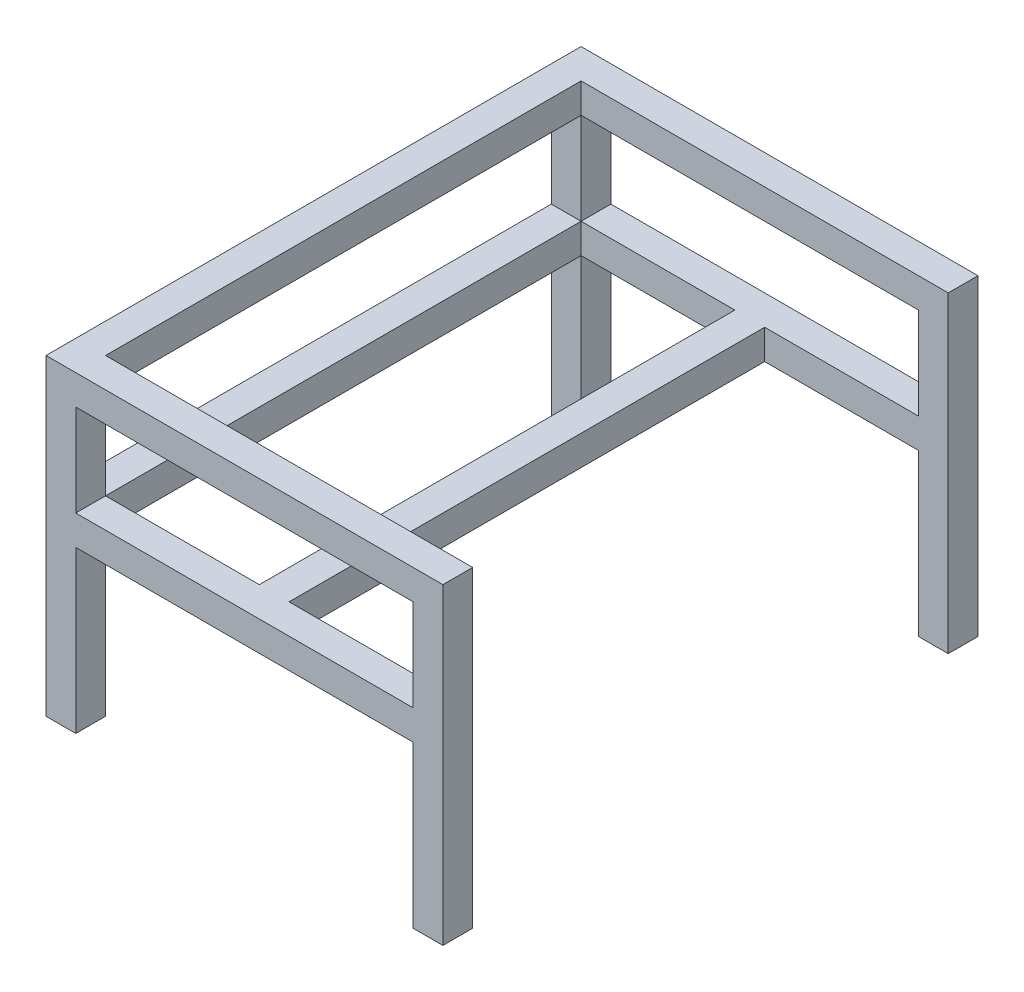
from build123d import *

# Parameters (mm, degrees)
CROQUIS1_W              = 1016.2
CROQUIS1_H              = 1370
SALIENTE_EXTRUIR1_DEPTH = 800
CORTAR_EXTRUIR1_DEPTH   = 723.8
CROQUIS3_W              = 863.8
CROQUIS3_H              = 1217.6
CORTAR_EXTRUIR2_DEPTH   = 76.2
CROQUIS5_W              = 1217.6
CROQUIS5_H              = 76.2
SALIENTE_EXTRUIR2_DEPTH = 76.2
CROQUIS6_W              = 863.8
CROQUIS6_H              = 76.2
SALIENTE_EXTRUIR3_DEPTH = 76.2
CROQUIS7_W              = 1217.6
CROQUIS7_H              = 76.2
SALIENTE_EXTRUIR4_DEPTH = 76.2
CROQUIS8_W              = 863.8
CROQUIS8_H              = 76.2
SALIENTE_EXTRUIR5_DEPTH = 76.2
CROQUIS9_W              = 76.2
CROQUIS9_H              = 1217.6
CORTAR_EXTRUIR4_DEPTH   = 387.4
CROQUIS10_W             = 76.2
CROQUIS10_H             = 76.2
SALIENTE_EXTRUIR6_DEPTH = 1217.6


with BuildPart() as part:
    # Croquis1 → Saliente-Extruir1 (new body)
    with BuildSketch(Plane(origin=(0, 0, 0), x_dir=(1, 0, 0), z_dir=(0, 1, 0))):
        Rectangle(CROQUIS1_W, CROQUIS1_H)
    extrude(amount=SALIENTE_EXTRUIR1_DEPTH)

    # Croquis2 → Cortar-Extruir1 (cut)
    with BuildSketch(Plane.XZ):
        Polygon((431.9, 608.8), (431.9, 685), (-431.9, 685), (-431.9, 608.8), (-508.1, 608.8), (-508.1, -608.8), (-431.9, -608.8), (-431.9, -685), (431.9, -685), (431.9, -608.8), (508.1, -608.8), (508.1, 608.8), align=None)
    extrude(amount=-CORTAR_EXTRUIR1_DEPTH, mode=Mode.SUBTRACT)

    # Croquis3 → Cortar-Extruir2 (cut)
    with BuildSketch(Plane(origin=(0, 800, 0), x_dir=(1, 0, 0), z_dir=(0, 1, 0))):
        Rectangle(CROQUIS3_W, CROQUIS3_H)
    extrude(amount=-CORTAR_EXTRUIR2_DEPTH, mode=Mode.SUBTRACT)

    # Croquis5 → Saliente-Extruir2 (add)
    with BuildSketch(Plane.ZY.offset(508.1)):
        with Locations((0, 450.7)):
            Rectangle(CROQUIS5_W, CROQUIS5_H)
    extrude(amount=-SALIENTE_EXTRUIR2_DEPTH)

    # Croquis6 → Saliente-Extruir3 (add)
    with BuildSketch(Plane(origin=(0, 0, -685), x_dir=(-1, 0, 0), z_dir=(0, 0, -1))):
        with Locations((0, 450.7)):
            Rectangle(CROQUIS6_W, CROQUIS6_H)
    extrude(amount=-SALIENTE_EXTRUIR3_DEPTH)

    # Croquis7 → Saliente-Extruir4 (add)
    with BuildSketch(Plane(origin=(508.1, 0, 0), x_dir=(0, 0, -1), z_dir=(1, 0, 0))):
        with Locations((0, 450.7)):
            Rectangle(CROQUIS7_W, CROQUIS7_H)
    extrude(amount=-SALIENTE_EXTRUIR4_DEPTH)

    # Croquis8 → Saliente-Extruir5 (add)
    with BuildSketch(Plane.XY.offset(685)):
        with Locations((0, 450.7)):
            Rectangle(CROQUIS8_W, CROQUIS8_H)
    extrude(amount=-SALIENTE_EXTRUIR5_DEPTH)

    # Croquis9 → Cortar-Extruir4 (cut)
    with BuildSketch(Plane(origin=(0, 800, 0), x_dir=(1, 0, 0), z_dir=(0, 1, 0))):
        with Locations((470, 0)):
            Rectangle(CROQUIS9_W, CROQUIS9_H)
    extrude(amount=-CORTAR_EXTRUIR4_DEPTH, mode=Mode.SUBTRACT)

    # Croquis10 → Saliente-Extruir6 (add)
    with BuildSketch(Plane.XY.offset(-608.8)):
        with Locations((0, 450.7)):
            Rectangle(CROQUIS10_W, CROQUIS10_H)
    extrude(amount=SALIENTE_EXTRUIR6_DEPTH)


solid = part.part
